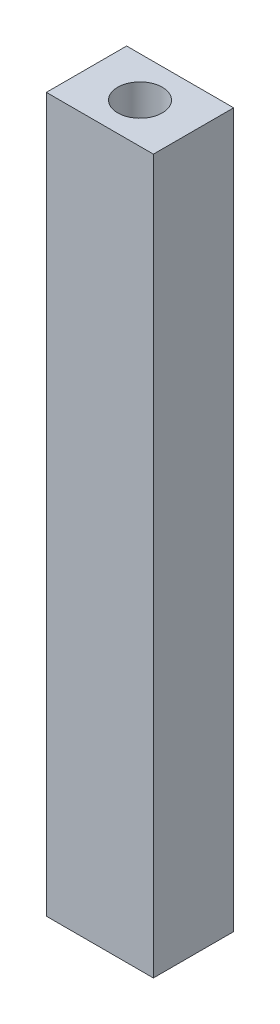
from build123d import *

# Parameters (mm, degrees)
SKETCH_2_W          = 12
SKETCH_2_H          = 9
EXTRUDE_1_DEPTH     = 80
SKETCH_3_R          = 3
CUT_EXTRUDE_1_DEPTH = 15
SKETCH_4_R          = 2.5
CUT_EXTRUDE_2_DEPTH = 15


with BuildPart() as part:
    # 草图2 → 凸台-拉伸1 (new body)
    with BuildSketch(Plane(origin=(0, 0, 0), x_dir=(1, 0, 0), z_dir=(0, 1, 0))):
        Rectangle(SKETCH_2_W, SKETCH_2_H)
    extrude(amount=EXTRUDE_1_DEPTH)

    # 草图3 → 切除-拉伸1 (cut)
    with BuildSketch(Plane.XZ):
        with Locations(Location((0, 0, 0), (0, 0, 270))):
            Circle(SKETCH_3_R)
    extrude(amount=-CUT_EXTRUDE_1_DEPTH, mode=Mode.SUBTRACT)

    # 草图4 → 切除-拉伸2 (cut)
    with BuildSketch(Plane(origin=(0, 80, 0), x_dir=(1, 0, 0), z_dir=(0, 1, 0))):
        with Locations(Location((0, 0, 0), (0, 0, 270))):
            Circle(SKETCH_4_R)
    extrude(amount=-CUT_EXTRUDE_2_DEPTH, mode=Mode.SUBTRACT)


solid = part.part
